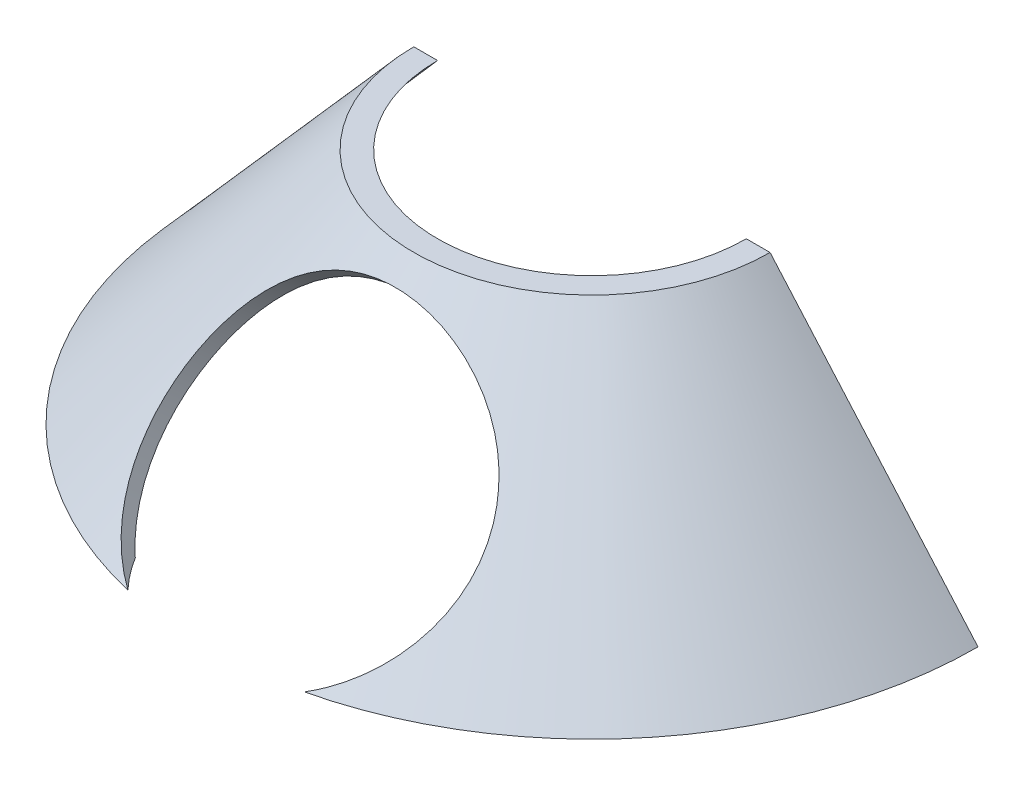
from build123d import *

# Parameters (mm, degrees)
REVOLVE1_ANGLE     = 180
SKETCH3_R          = 26
CUT_EXTRUDE1_DEPTH = 10


with BuildPart() as part:
    # Sketch1 → Revolve1 (revolve)
    with BuildSketch(Plane.XY):
        Polygon((26, 40), (61, 0), (65.013813376, -0.015786716), (30, 40), align=None)
    revolve(axis=Axis((0, 40, 0), (0, -1, 0)), revolution_arc=REVOLVE1_ANGLE)

    # Sketch3 → Cut-Extrude1 (cut)
    with BuildSketch(Plane(origin=(0, 32.212389381, 36.814159292), x_dir=(1, 0, 0), z_dir=(0, 0.6585046078685183, 0.7525766947068778))):
        with Locations((0, -20.352106134)):
            Circle(SKETCH3_R)
    extrude(amount=-CUT_EXTRUDE1_DEPTH, mode=Mode.SUBTRACT)


solid = part.part
